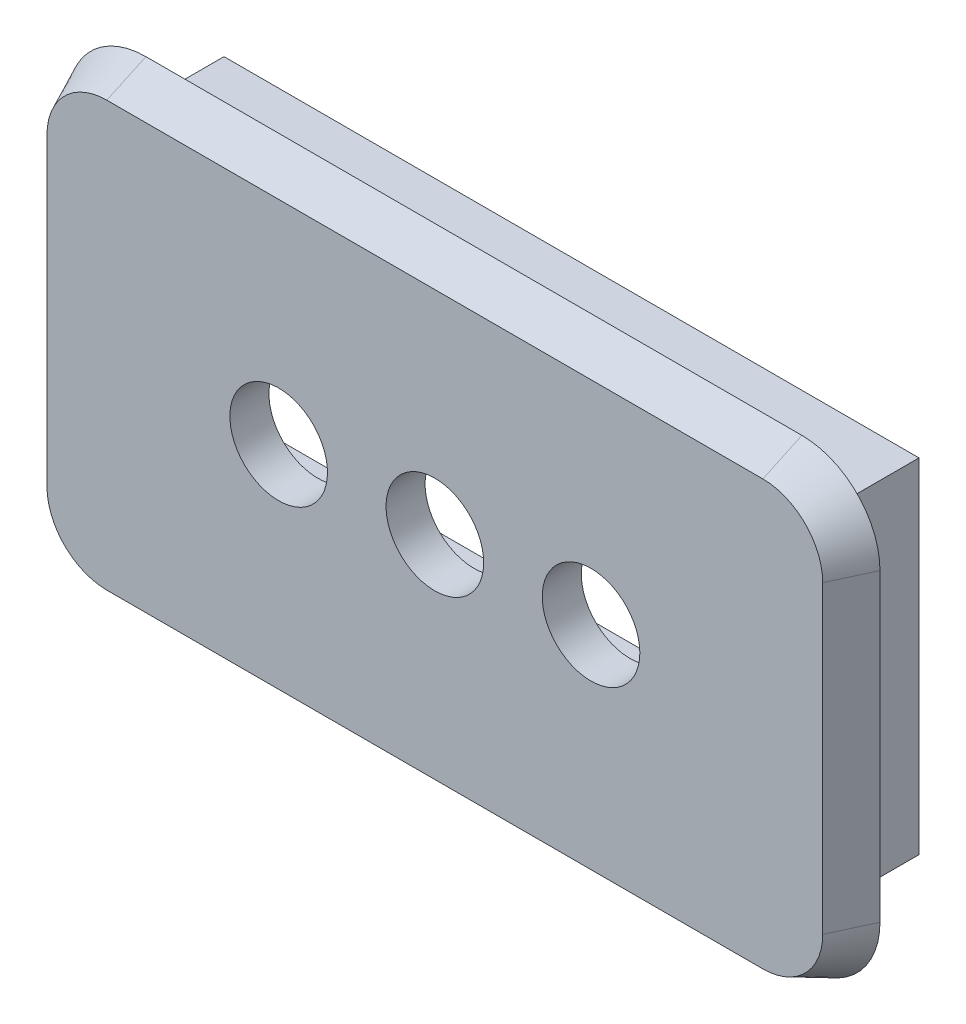
from build123d import *

# Parameters (mm, degrees)
SKETCH_1_W          = 17.8
SKETCH_1_H          = 8.8
SKETCH_1_W_2        = 15.8
SKETCH_1_H_2        = 6.8
EXTRUDE_1_DEPTH     = 2.5
EXTRUDE_2_DEPTH     = 1
EXTRUDE_2_TAPER     = 25
CUT_EXTRUDE_1_REACH = 35.401
SKETCH_3_R          = 1.25


with BuildPart() as part:
    # 草图1 → 凸台-拉伸1 (new body)
    with BuildSketch(Plane.XY):
        with Locations((0.435, 25.5)):
            Rectangle(SKETCH_1_W, SKETCH_1_H)
        with Locations((0.435, 25.5)):
            Rectangle(SKETCH_1_W_2, SKETCH_1_H_2, mode=Mode.SUBTRACT)
    extrude(amount=-EXTRUDE_1_DEPTH)

    # 草图2 → 凸台-拉伸2 (add)
    with BuildSketch(Plane.XY):
        with BuildLine():
            Line((10.835, 21.6), (10.835, 29.4))
            ThreePointArc((10.835, 29.4), (10.249213562, 30.814213562), (8.835, 31.4))
            Line((8.835, 31.4), (-7.965, 31.4))
            ThreePointArc((-7.965, 31.4), (-9.379213562, 30.814213562), (-9.965, 29.4))
            Line((-9.965, 29.4), (-9.965, 21.6))
            ThreePointArc((-9.965, 21.6), (-9.379213562, 20.185786438), (-7.965, 19.6))
            Line((-7.965, 19.6), (8.835, 19.6))
            ThreePointArc((8.835, 19.6), (10.249213562, 20.185786438), (10.835, 21.6))
        make_face()
    extrude(amount=EXTRUDE_2_DEPTH, taper=EXTRUDE_2_TAPER)

    # 草图3 → 切除-拉伸1 (cut, up to next)
    with BuildSketch(Plane.XY.offset(1), mode=Mode.PRIVATE) as cut_extrude_1_sk1:
        with Locations((0.435, 25.5)):
            Circle(SKETCH_3_R)
    cut_extrude_1_tool1 = extrude(cut_extrude_1_sk1.sketch, amount=-CUT_EXTRUDE_1_REACH, mode=Mode.PRIVATE) & part.part
    # 草图3 → 切除-拉伸1 (cut, up to next)
    with BuildSketch(Plane.XY.offset(1), mode=Mode.PRIVATE) as cut_extrude_1_sk2:
        with Locations((-3.565, 25.5)):
            Circle(SKETCH_3_R)
    cut_extrude_1_tool2 = extrude(cut_extrude_1_sk2.sketch, amount=-CUT_EXTRUDE_1_REACH, mode=Mode.PRIVATE) & part.part
    # 草图3 → 切除-拉伸1 (cut, up to next)
    with BuildSketch(Plane.XY.offset(1), mode=Mode.PRIVATE) as cut_extrude_1_sk3:
        with Locations((4.435, 25.5)):
            Circle(SKETCH_3_R)
    cut_extrude_1_tool3 = extrude(cut_extrude_1_sk3.sketch, amount=-CUT_EXTRUDE_1_REACH, mode=Mode.PRIVATE) & part.part
    add(cut_extrude_1_tool1.solids().sort_by_distance((0.435, 25.5, 1))[0], mode=Mode.SUBTRACT)
    add(cut_extrude_1_tool2.solids().sort_by_distance((-3.565, 25.5, 1))[0], mode=Mode.SUBTRACT)
    add(cut_extrude_1_tool3.solids().sort_by_distance((4.435, 25.5, 1))[0], mode=Mode.SUBTRACT)


solid = part.part
